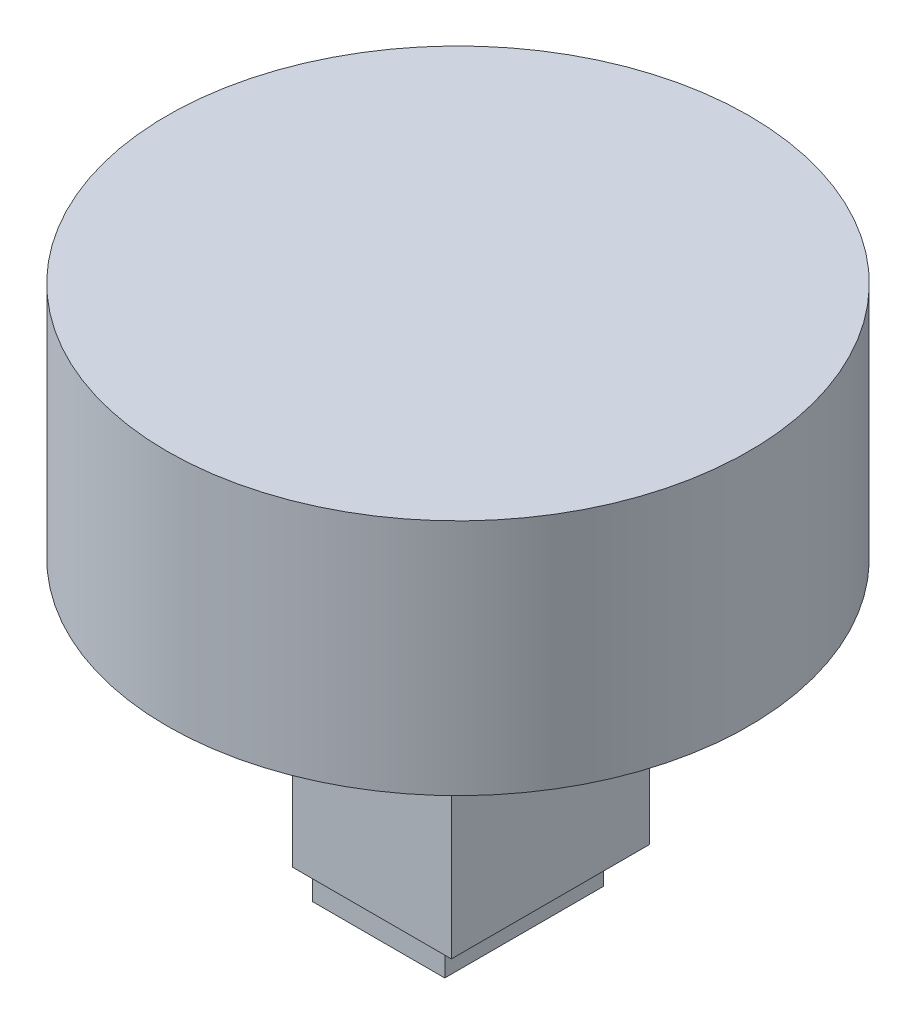
from build123d import *

# Parameters (mm, degrees)
SKETCH_1_R                  = 22
EXTRUDE_1_DEPTH             = 18
SKETCH_2_W                  = 10
SKETCH_2_H                  = 12
EXTRUDE_2_DEPTH             = 22
SKETCH_3_W                  = 15
SKETCH_3_H                  = 12
EXTRUDE_3_DEPTH             = 2
EXTRUDE_3_DIRECTION_2_REACH = 43.195


with BuildPart() as part:
    # 草图1 → 凸台-拉伸1 (new body)
    with BuildSketch(Plane(origin=(0, 0, 0), x_dir=(1, 0, 0), z_dir=(0, 1, 0))):
        with Locations(Location((0, 0, 0), (0, 0, 270))):
            Circle(SKETCH_1_R)
    extrude(amount=EXTRUDE_1_DEPTH)

    # 草图2 → 凸台-拉伸2 (add)
    with BuildSketch(Plane.XZ):
        Rectangle(SKETCH_2_W, SKETCH_2_H)
    extrude(amount=EXTRUDE_2_DEPTH)

    # 草图3 → 凸台-拉伸3 (add)
    with BuildSketch(Plane(origin=(5, 0, 0), x_dir=(0, 0, -1), z_dir=(1, 0, 0))):
        with Locations((0, -13)):
            Rectangle(SKETCH_3_W, SKETCH_3_H)
    extrude(amount=EXTRUDE_3_DEPTH)

    # 凸台-拉伸3 direction 2: up to this face of the body (flat: up to its plane)
    extrude_3_direction_2_end = Plane(part.part.faces().sort_by_distance((-5, -11, 0))[0])
    # 草图3 → 凸台-拉伸3 direction 2 (add, up to the picked face)
    with BuildSketch(Plane(origin=(5, 0, 0), x_dir=(0, 0, -1), z_dir=(1, 0, 0)), mode=Mode.PRIVATE) as extrude_3_direction_2_sk1:
        with Locations((0, -13)):
            Rectangle(SKETCH_3_W, SKETCH_3_H)
    extrude_3_direction_2_tool1 = split(extrude(extrude_3_direction_2_sk1.sketch, amount=-EXTRUDE_3_DIRECTION_2_REACH, mode=Mode.PRIVATE), bisect_by=extrude_3_direction_2_end, keep=Keep.BOTH, mode=Mode.PRIVATE)
    add(extrude_3_direction_2_tool1.solids().sort_by(Axis((5, -13, 0), (-1, 0, 0)))[0])


solid = part.part
